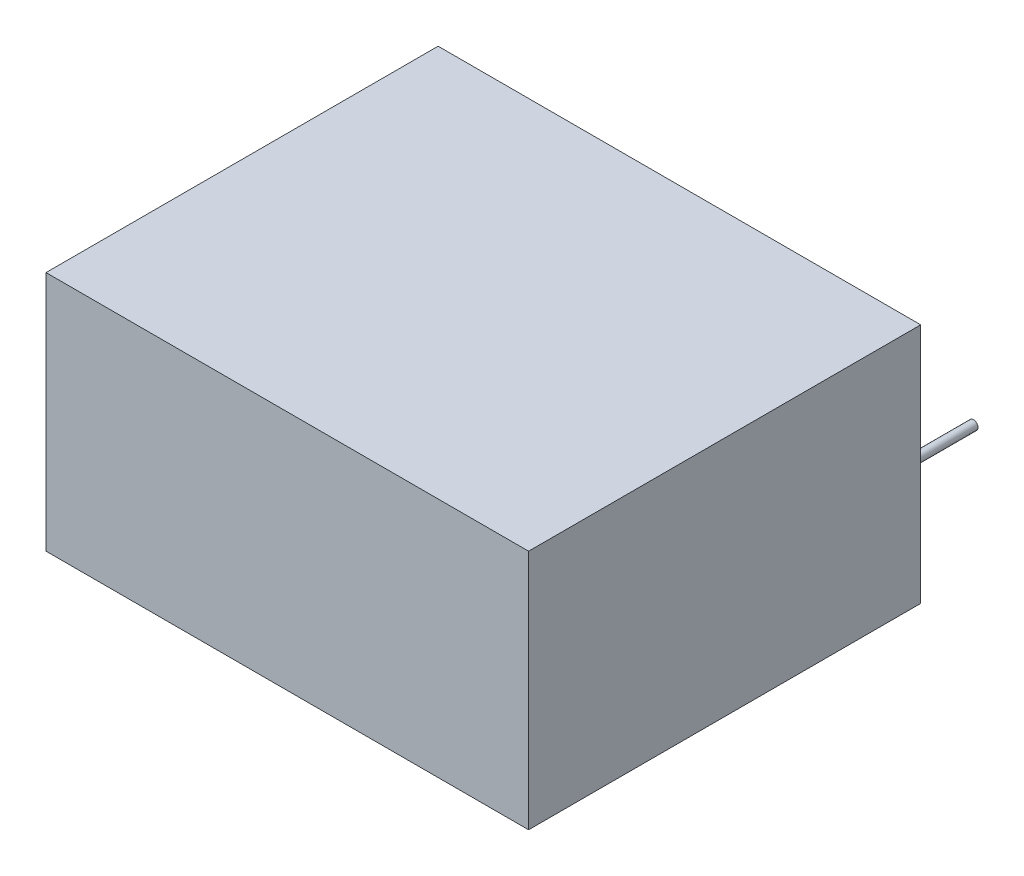
from build123d import *

# Parameters (mm, degrees)
SKETCH_2_W      = 32
SKETCH_2_H      = 16
EXTRUDE_1_DEPTH = 26
SKETCH_3_R      = 0.4
SKETCH_3_R_2    = 0.3
EXTRUDE_2_DEPTH = 4


with BuildPart() as part:
    # Эскиз2 → Вытянуть1 (new body)
    with BuildSketch(Plane.XY):
        with Locations((15.5, 0)):
            Rectangle(SKETCH_2_W, SKETCH_2_H)
    extrude(amount=EXTRUDE_1_DEPTH)

    # Эскиз3 → Вытянуть2 (add)
    with BuildSketch(Plane(origin=(0, 0, 0), x_dir=(-1, 0, 0), z_dir=(0, 0, -1))):
        with Locations(Location((0, 0, 0), (0, 0, 180))):
            Circle(SKETCH_3_R)
        with Locations(Location((-31, 0, 0), (0, 0, 180))):
            Circle(SKETCH_3_R_2)
    extrude(amount=EXTRUDE_2_DEPTH)


solid = part.part
